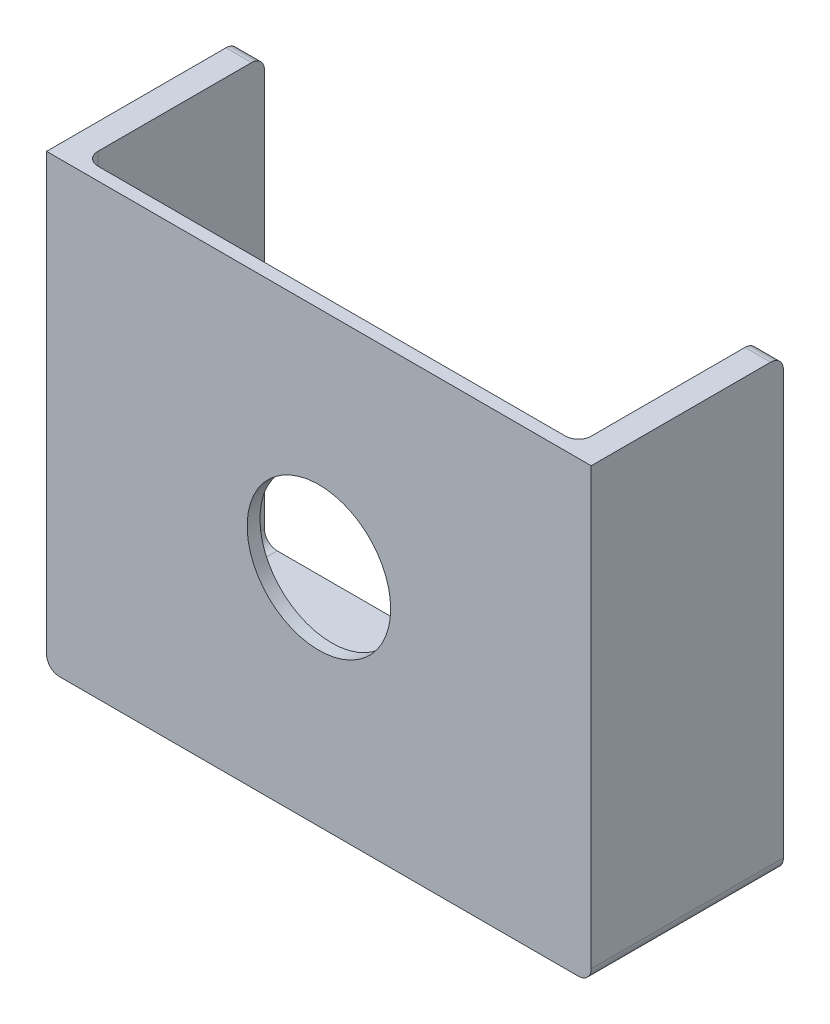
from build123d import *

# Parameters (mm, degrees)
SKETCH1_W            = 85
SKETCH1_H            = 70
BOSS_EXTRUDE1_DEPTH  = 2
HOLE1_D              = 22.4
SKETCH5_W            = 28
SKETCH5_H            = 4
BOSS_EXTRUDE2_DEPTH  = 85
BOSS_EXTRUDE3_REACH  = 115.618
SKETCH6_W            = 4
SKETCH6_H            = 28
M4_CLEARANCE_HOLE1_D = 4.8
FILLET1_R            = 2


with BuildPart() as part:
    # Sketch1 → Boss-Extrude1 (new body)
    with BuildSketch(Plane.XY):
        with Locations((42.5, 35)):
            Rectangle(SKETCH1_W, SKETCH1_H)
    extrude(amount=BOSS_EXTRUDE1_DEPTH)

    # Hole1 (through all)
    with Locations(Plane.XY.offset(2)):
        with Locations((42.5, 35)):
            Hole(HOLE1_D / 2)

    # Sketch5 → Boss-Extrude2 (add)
    with BuildSketch(Plane(origin=(85, 0, 0), x_dir=(0, 0, -1), z_dir=(1, 0, 0))):
        with Locations((14, 2)):
            Rectangle(SKETCH5_W, SKETCH5_H)
    extrude(amount=-BOSS_EXTRUDE2_DEPTH)

    # Sketch6 → Boss-Extrude3 (add, up to next)
    with BuildSketch(Plane(origin=(0, 70, 0), x_dir=(1, 0, 0), z_dir=(0, 1, 0)), mode=Mode.PRIVATE) as boss_extrude3_sk1:
        with Locations((83, 14)):
            Rectangle(SKETCH6_W, SKETCH6_H)
    boss_extrude3_tool1 = extrude(boss_extrude3_sk1.sketch, amount=-BOSS_EXTRUDE3_REACH, mode=Mode.PRIVATE) - part.part
    # Sketch6 → Boss-Extrude3 (add, up to next)
    with BuildSketch(Plane(origin=(0, 70, 0), x_dir=(1, 0, 0), z_dir=(0, 1, 0)), mode=Mode.PRIVATE) as boss_extrude3_sk2:
        with Locations((2, 14)):
            Rectangle(SKETCH6_W, SKETCH6_H)
    boss_extrude3_tool2 = extrude(boss_extrude3_sk2.sketch, amount=-BOSS_EXTRUDE3_REACH, mode=Mode.PRIVATE) - part.part
    add(boss_extrude3_tool1.solids().sort_by_distance((83, 70, -14))[0])
    add(boss_extrude3_tool2.solids().sort_by_distance((2, 70, -14))[0])

    # M4 Clearance Hole1 (through all)
    with Locations(Plane(origin=(0, 4, 0), x_dir=(1, 0, 0), z_dir=(0, 1, 0))):
        with Locations((15, 13), (70, 13)):
            Hole(M4_CLEARANCE_HOLE1_D / 2)

    # Fillet1
    fillet1_edges = [part.edges().sort_by_distance(p)[0] for p in [
        (81, 4, -14),
        (81, 37, 0),
        (83, 70, -28),
        (42.5, 4, 0),
        (4, 4, -14),
        (2, 70, -28),
        (4, 37, 0),
        (85, 0, -13),
        (0, 0, -13),
    ]]
    fillet(fillet1_edges, radius=FILLET1_R)


solid = part.part
